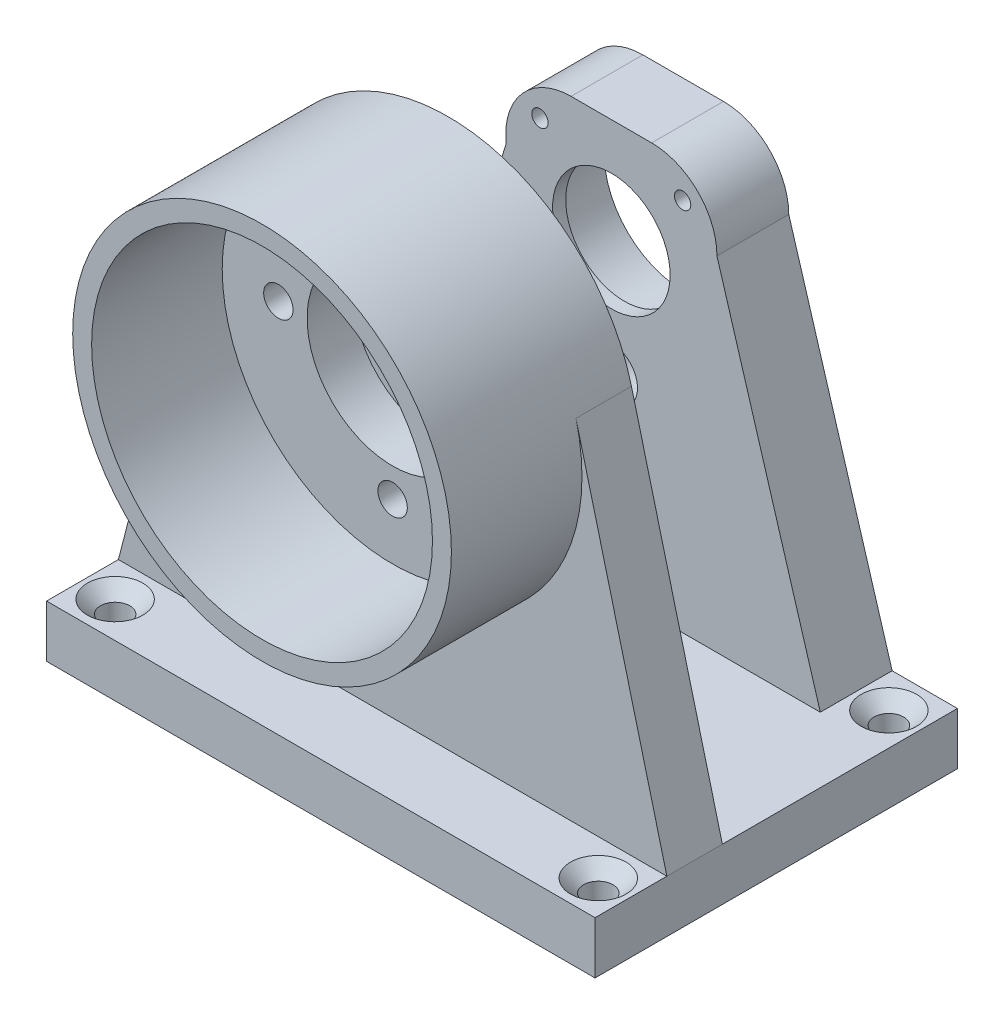
from build123d import *

# Parameters (mm, degrees)
SCHIZZO1_R                   = 12.1
ESTRUSIONE_ESTRUSIONE1_DEPTH = 11
ESTRUSIONE_ESTRUSIONE2_START = -2
SCHIZZO2_R                   = 12.1
SCHIZZO2_R_2                 = 9
ESTRUSIONE_ESTRUSIONE2_DEPTH = 2
SCHIZZO3_R                   = 2.25
TAGLIO_ESTRUSIONE1_DEPTH     = 77.182412669
SMUSSO1_SIZE                 = 2
SCHIZZO4_R                   = 1.25
TAGLIO_ESTRUSIONE2_DEPTH     = 70.679623994
SCHIZZO5_W                   = 84
SCHIZZO5_H                   = 8
ESTRUSIONE_ESTRUSIONE3_DEPTH = 25
SCHIZZO6_R                   = 2.25
SCHIZZO6_R_2                 = 6
ESTRUSIONE_ESTRUSIONE4_DEPTH = 1.5
SCHIZZO7_R                   = 2.25
SCHIZZO7_R_2                 = 13.1
ESTRUSIONE_ESTRUSIONE5_DEPTH = 7
SCHIZZO8_R                   = 29
SCHIZZO8_R_2                 = 26.1
ESTRUSIONE_ESTRUSIONE6_DEPTH = 20
TAGLIO_ESTRUSIONE4_REACH     = 96.311
SCHIZZO9_R                   = 4
SCHIZZO10_W                  = 84
SCHIZZO10_H                  = 8
ESTRUSIONE_ESTRUSIONE7_DEPTH = 11
SCHIZZO11_R                  = 2.25
TAGLIO_ESTRUSIONE5_DEPTH     = 108.816974545
SMUSSO2_SIZE                 = 2


with BuildPart() as part:
    # Schizzo1 → Estrusione-Estrusione1 (new body)
    with BuildSketch(Plane.XY):
        with BuildLine():
            Line((-6.171311325, 16.1), (6.171311325, 16.1))
            ThreePointArc((6.171311325, 16.1), (13.242379137, 13.171067812), (16.171311325, 6.1))
            Line((16.171311325, 6.1), (32, -46.5))
            Line((32, -46.5), (42, -46.5))
            Line((42, -46.5), (42, -54.5))
            Line((42, -54.5), (17, -54.5))
            Line((17, -54.5), (-17, -54.5))
            Line((-17, -54.5), (-42, -54.5))
            Line((-42, -54.5), (-42, -46.5))
            Line((-42, -46.5), (-32, -46.5))
            Line((-32, -46.5), (-16.1, 4.907883736))
            ThreePointArc((-16.1, 4.907883736), (-13.651991863, 12.73622021), (-6.171311325, 16.1))
        make_face()
        Circle(SCHIZZO1_R, mode=Mode.SUBTRACT)
    extrude(amount=ESTRUSIONE_ESTRUSIONE1_DEPTH)

    # Schizzo2 → Estrusione-Estrusione2 (add)
    with BuildSketch(Plane.XY.offset(11).offset(ESTRUSIONE_ESTRUSIONE2_START)):
        Circle(SCHIZZO2_R)
        Circle(SCHIZZO2_R_2, mode=Mode.SUBTRACT)
    extrude(amount=ESTRUSIONE_ESTRUSIONE2_DEPTH)

    # Schizzo3 → Taglio-Estrusione1 (cut, through all)
    with BuildSketch(Plane(origin=(0, -46.5, 0), x_dir=(1, 0, 0), z_dir=(0, 1, 0))):
        with Locations(Location((37, -5.5, 0), (0, 0, 270))):
            Circle(SCHIZZO3_R)
        with Locations(Location((-37, -5.5, 0), (0, 0, 270))):
            Circle(SCHIZZO3_R)
    extrude(amount=-TAGLIO_ESTRUSIONE1_DEPTH, mode=Mode.SUBTRACT)

    # Smusso1
    smusso1_edges = [part.edges().sort_by_distance(p)[0] for p in [
        (37, -46.5, 3.25),
        (-37, -46.5, 3.25),
    ]]
    chamfer(smusso1_edges, length=SMUSSO1_SIZE)

    # Schizzo4 → Taglio-Estrusione2 (cut, through all)
    with BuildSketch(Plane(origin=(0, 0, 0), x_dir=(-1, 0, 0), z_dir=(0, 0, -1))):
        with Locations((-10.910719744, 10.851964601)):
            Circle(SCHIZZO4_R)
        with Locations((10.944459062, 10.817992606)):
            Circle(SCHIZZO4_R)
        with Locations((0, -15.38859776)):
            Circle(SCHIZZO4_R)
    extrude(amount=-TAGLIO_ESTRUSIONE2_DEPTH, mode=Mode.SUBTRACT)

    # Schizzo5 → Estrusione-Estrusione3 (add)
    with BuildSketch(Plane.XY.offset(11)):
        with Locations((0, -50.5)):
            Rectangle(SCHIZZO5_W, SCHIZZO5_H)
    extrude(amount=ESTRUSIONE_ESTRUSIONE3_DEPTH)

    # Schizzo6 → Estrusione-Estrusione4 (add)
    with BuildSketch(Plane.XY.offset(36)):
        with BuildLine():
            Line((-28.073726485, 7.270892739), (-42, -46.5))
            Line((-42, -46.5), (-42, -54.5))
            Line((-42, -54.5), (42, -54.5))
            Line((42, -54.5), (42, -46.5))
            Line((42, -46.5), (28.073726485, 7.270892739))
            ThreePointArc((28.073726485, 7.270892739), (0, 29), (-28.073726485, 7.270892739))
        make_face()
        with Locations((17.5, 0)):
            Circle(SCHIZZO6_R, mode=Mode.SUBTRACT)
        with Locations((0, -17.5)):
            Circle(SCHIZZO6_R, mode=Mode.SUBTRACT)
        with Locations((-17.5, 0)):
            Circle(SCHIZZO6_R, mode=Mode.SUBTRACT)
        with Locations((0, 17.5)):
            Circle(SCHIZZO6_R, mode=Mode.SUBTRACT)
        Circle(SCHIZZO6_R_2, mode=Mode.SUBTRACT)
    extrude(amount=ESTRUSIONE_ESTRUSIONE4_DEPTH)

    # Schizzo7 → Estrusione-Estrusione5 (add)
    with BuildSketch(Plane.XY.offset(37.5)):
        with BuildLine():
            Line((42, -46.5), (28.073726485, 7.270892739))
            ThreePointArc((28.073726485, 7.270892739), (0, 29), (-28.073726485, 7.270892739))
            Line((-28.073726485, 7.270892739), (-42, -46.5))
            Line((-42, -46.5), (-42, -54.5))
            Line((-42, -54.5), (42, -54.5))
            Line((42, -54.5), (42, -46.5))
        make_face()
        with Locations((0, -17.5)):
            Circle(SCHIZZO7_R, mode=Mode.SUBTRACT)
        with Locations((17.5, 0)):
            Circle(SCHIZZO7_R, mode=Mode.SUBTRACT)
        with Locations((0, 17.5)):
            Circle(SCHIZZO7_R, mode=Mode.SUBTRACT)
        with Locations((-17.5, 0)):
            Circle(SCHIZZO7_R, mode=Mode.SUBTRACT)
        Circle(SCHIZZO7_R_2, mode=Mode.SUBTRACT)
    extrude(amount=ESTRUSIONE_ESTRUSIONE5_DEPTH)

    # Schizzo8 → Estrusione-Estrusione6 (add)
    with BuildSketch(Plane.XY.offset(44.5)):
        with Locations(Location((0, 0, 0), (0, 0, 165.479851844))):
            Circle(SCHIZZO8_R)
        Circle(SCHIZZO8_R_2, mode=Mode.SUBTRACT)
    extrude(amount=ESTRUSIONE_ESTRUSIONE6_DEPTH)

    # Schizzo9 → Taglio-Estrusione4 (cut, up to next)
    with BuildSketch(Plane(origin=(0, 0, 0), x_dir=(-1, 0, 0), z_dir=(0, 0, -1)), mode=Mode.PRIVATE) as taglio_estrusione4_sk1:
        with Locations((0, -17.5)):
            Circle(SCHIZZO9_R)
    taglio_estrusione4_tool1 = extrude(taglio_estrusione4_sk1.sketch, amount=-TAGLIO_ESTRUSIONE4_REACH, mode=Mode.PRIVATE) & part.part
    add(taglio_estrusione4_tool1.solids().sort_by_distance((0, -17.5, 0))[0], mode=Mode.SUBTRACT)

    # Schizzo10 → Estrusione-Estrusione7 (add)
    with BuildSketch(Plane.XY.offset(44.5)):
        with Locations((0, -50.5)):
            Rectangle(SCHIZZO10_W, SCHIZZO10_H)
    extrude(amount=ESTRUSIONE_ESTRUSIONE7_DEPTH)

    # Schizzo11 → Taglio-Estrusione5 (cut, through all)
    with BuildSketch(Plane(origin=(0, -46.5, 0), x_dir=(1, 0, 0), z_dir=(0, 1, 0))):
        with Locations(Location((-37, -50, 0), (0, 0, 270))):
            Circle(SCHIZZO11_R)
        with Locations(Location((37, -50, 0), (0, 0, 270))):
            Circle(SCHIZZO11_R)
    extrude(amount=-TAGLIO_ESTRUSIONE5_DEPTH, mode=Mode.SUBTRACT)

    # Smusso2
    smusso2_edges = [part.edges().sort_by_distance(p)[0] for p in [
        (-37, -46.5, 47.75),
        (37, -46.5, 47.75),
    ]]
    chamfer(smusso2_edges, length=SMUSSO2_SIZE)


solid = part.part
